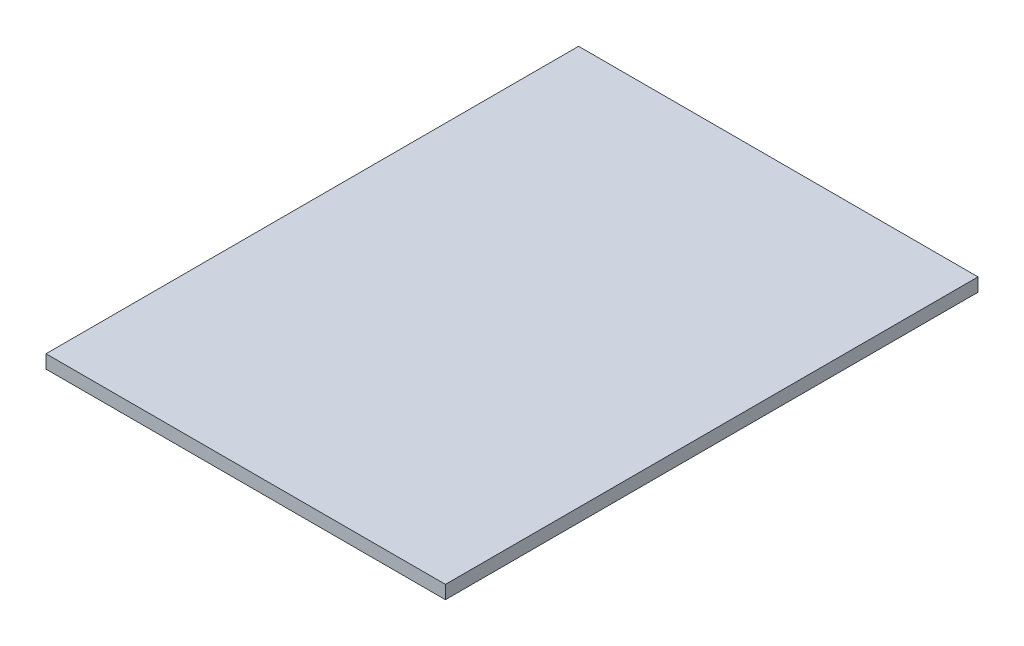
from build123d import *

# Parameters (mm, degrees)
SKETCH1_W           = 95.25
SKETCH1_H           = 127
BOSS_EXTRUDE1_DEPTH = 3.175


with BuildPart() as part:
    # Sketch1 → Boss-Extrude1 (new body)
    with BuildSketch(Plane(origin=(0, 0, 0), x_dir=(1, 0, 0), z_dir=(0, 1, 0))):
        Rectangle(SKETCH1_W, SKETCH1_H)
    extrude(amount=BOSS_EXTRUDE1_DEPTH)


solid = part.part
